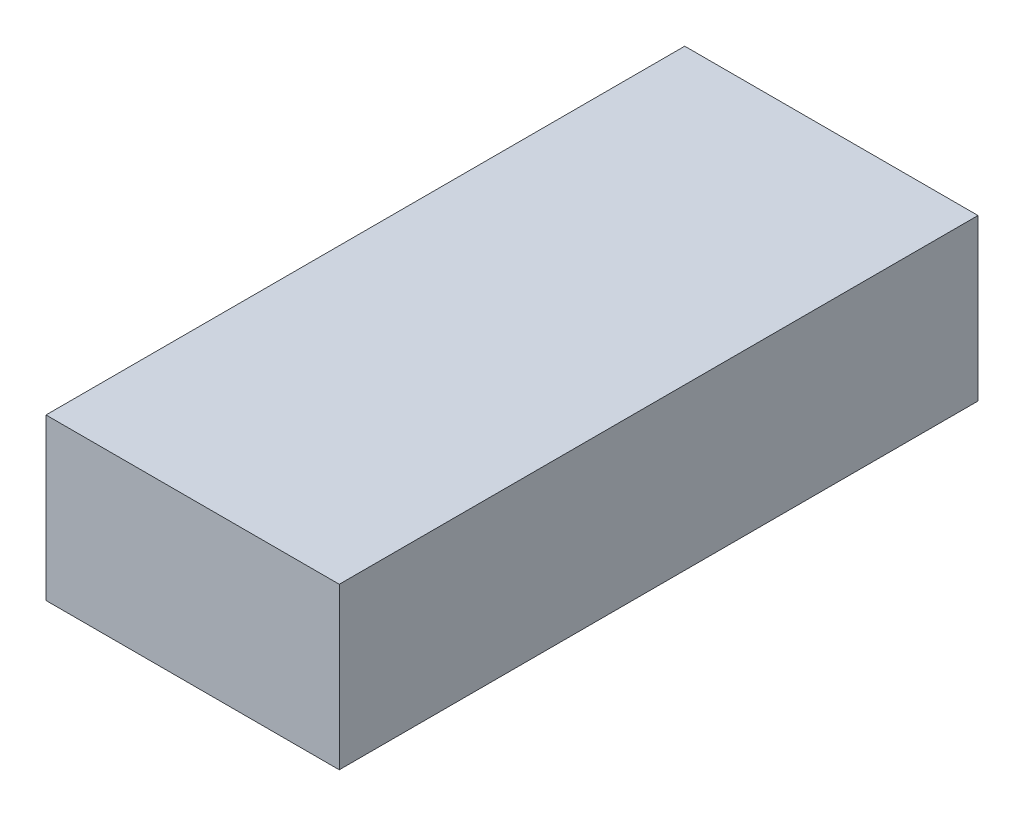
from build123d import *

# Parameters (mm, degrees)
CURVEBOSS_DEPTH      = 57.113
CURVEBOSS_DEPTH_BACK = 11.971
CURVESKETCH_W        = 31.719
CURVESKETCH_H        = 17.381


with BuildPart() as part:
    # CurveSketch → CurveBoss (new, two sides: drawn at the far end of the back side and taken through both)
    with BuildSketch(Plane.XY.offset(-CURVEBOSS_DEPTH_BACK)):
        with Locations((-4.193, 6.827)):
            Rectangle(CURVESKETCH_W, CURVESKETCH_H)
    extrude(amount=CURVEBOSS_DEPTH + CURVEBOSS_DEPTH_BACK)


solid = part.part
